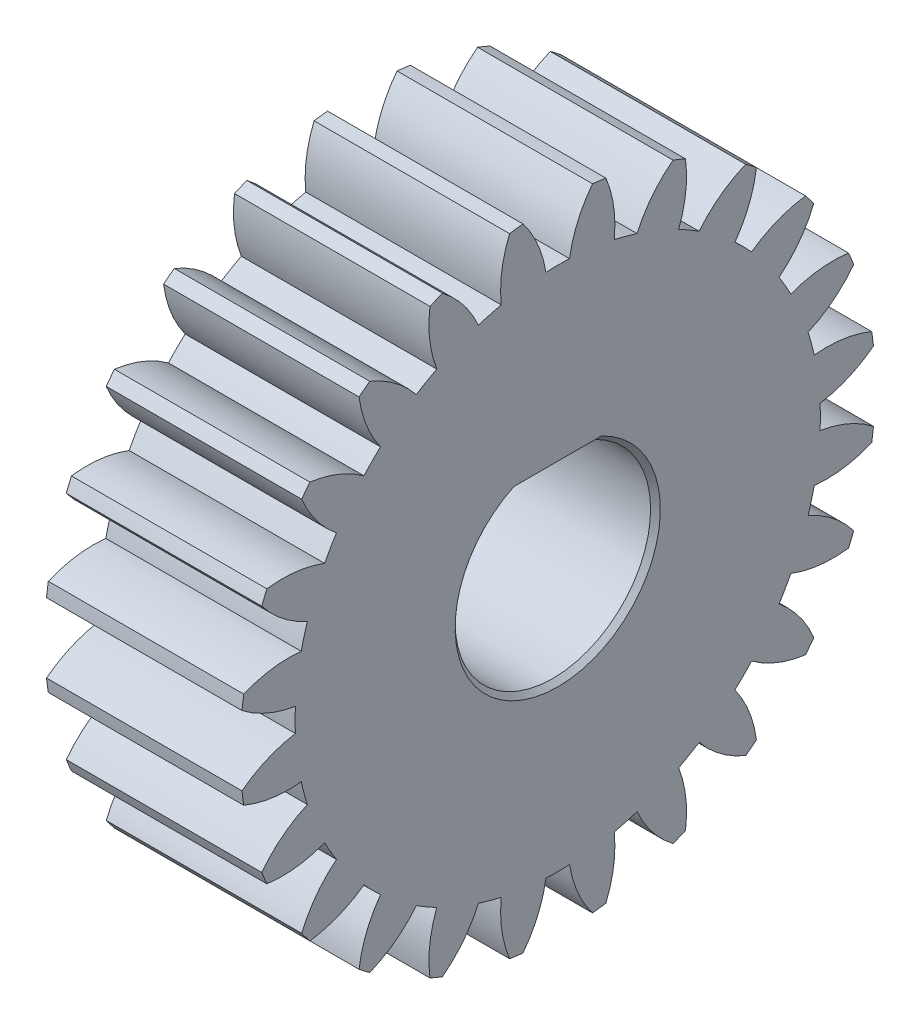
from build123d import *

# Parameters (mm, degrees)
EXTRUDE_1_DEPTH = 4
CHAMFER_1_SIZE  = 0.1


with BuildPart() as part:
    # 草图1 → 凸台-拉伸1 (new body)
    with BuildSketch(Plane(origin=(0, 0, 0), x_dir=(0, -1, 0), z_dir=(-1, 0, 0))):
        with BuildLine():
            ThreePointArc((-0.711337602, 6.460959589), (-0.848420249, 6.444391599), (-0.98512003, 6.424915449))
            ThreePointArc((-0.98512003, 6.424915449), (-1.144628565, 5.84730165), (-1.156074481, 5.248177569))
            ThreePointArc((-1.156074481, 5.248177569), (-1.390893548, 5.19088539), (-1.622898915, 5.123092339))
            ThreePointArc((-1.622898915, 5.123092339), (-1.93237341, 5.636226055), (-2.359318752, 6.056700011))
            ThreePointArc((-2.359318752, 6.056700011), (-2.48744231, 6.005216961), (-2.614443361, 5.951023938))
            ThreePointArc((-2.614443361, 5.951023938), (-2.619019322, 5.351808006), (-2.475010506, 4.770136161))
            ThreePointArc((-2.475010506, 4.770136161), (-2.687, 4.65402052), (-2.893553842, 4.528490053))
            ThreePointArc((-2.893553842, 4.528490053), (-3.325292028, 4.944041268), (-3.846516229, 5.239686336))
            ThreePointArc((-3.846516229, 5.239686336), (-3.956949289, 5.156796712), (-4.065596697, 5.071579981))
            ThreePointArc((-4.065596697, 5.071579981), (-3.91492824, 4.49159749), (-3.625278654, 3.967017857))
            ThreePointArc((-3.625278654, 3.967017857), (-3.799991842, 3.799991842), (-3.967017857, 3.625278654))
            ThreePointArc((-3.967017857, 3.625278654), (-4.49159749, 3.91492824), (-5.071579981, 4.065596697))
            ThreePointArc((-5.071579981, 4.065596697), (-5.156796712, 3.956949289), (-5.239686336, 3.846516229))
            ThreePointArc((-5.239686336, 3.846516229), (-4.944041268, 3.325292028), (-4.528490053, 2.893553842))
            ThreePointArc((-4.528490053, 2.893553842), (-4.65402052, 2.687), (-4.770136161, 2.475010506))
            ThreePointArc((-4.770136161, 2.475010506), (-5.351808006, 2.619019322), (-5.951023938, 2.614443361))
            ThreePointArc((-5.951023938, 2.614443361), (-6.005216961, 2.48744231), (-6.056700011, 2.359318752))
            ThreePointArc((-6.056700011, 2.359318752), (-5.636226055, 1.93237341), (-5.123092339, 1.622898915))
            ThreePointArc((-5.123092339, 1.622898915), (-5.19088539, 1.390893548), (-5.248177569, 1.156074481))
            ThreePointArc((-5.248177569, 1.156074481), (-5.84730165, 1.144628565), (-6.424915449, 0.98512003))
            ThreePointArc((-6.424915449, 0.98512003), (-6.444391599, 0.848420249), (-6.460959589, 0.711337602))
            ThreePointArc((-6.460959589, 0.711337602), (-5.94431135, 0.407766737), (-5.368564348, 0.241646108))
            ThreePointArc((-5.368564348, 0.241646108), (-5.374, 0), (-5.368564348, -0.241646108))
            ThreePointArc((-5.368564348, -0.241646108), (-5.94431135, -0.407766737), (-6.460959589, -0.711337602))
            ThreePointArc((-6.460959589, -0.711337602), (-6.444391599, -0.848420249), (-6.424915449, -0.98512003))
            ThreePointArc((-6.424915449, -0.98512003), (-5.84730165, -1.144628565), (-5.248177569, -1.156074481))
            ThreePointArc((-5.248177569, -1.156074481), (-5.19088539, -1.390893548), (-5.123092339, -1.622898915))
            ThreePointArc((-5.123092339, -1.622898915), (-5.636226055, -1.93237341), (-6.056700011, -2.359318752))
            ThreePointArc((-6.056700011, -2.359318752), (-6.005216961, -2.48744231), (-5.951023938, -2.614443361))
            ThreePointArc((-5.951023938, -2.614443361), (-5.351808006, -2.619019322), (-4.770136161, -2.475010506))
            ThreePointArc((-4.770136161, -2.475010506), (-4.65402052, -2.687), (-4.528490053, -2.893553842))
            ThreePointArc((-4.528490053, -2.893553842), (-4.944041268, -3.325292028), (-5.239686336, -3.846516229))
            ThreePointArc((-5.239686336, -3.846516229), (-5.156796712, -3.956949289), (-5.071579981, -4.065596697))
            ThreePointArc((-5.071579981, -4.065596697), (-4.49159749, -3.91492824), (-3.967017857, -3.625278654))
            ThreePointArc((-3.967017857, -3.625278654), (-3.799991842, -3.799991842), (-3.625278654, -3.967017857))
            ThreePointArc((-3.625278654, -3.967017857), (-3.91492824, -4.49159749), (-4.065596697, -5.071579981))
            ThreePointArc((-4.065596697, -5.071579981), (-3.956949289, -5.156796712), (-3.846516229, -5.239686336))
            ThreePointArc((-3.846516229, -5.239686336), (-3.325292028, -4.944041268), (-2.893553842, -4.528490053))
            ThreePointArc((-2.893553842, -4.528490053), (-2.687, -4.65402052), (-2.475010506, -4.770136161))
            ThreePointArc((-2.475010506, -4.770136161), (-2.619019322, -5.351808006), (-2.614443361, -5.951023938))
            ThreePointArc((-2.614443361, -5.951023938), (-2.48744231, -6.005216961), (-2.359318752, -6.056700011))
            ThreePointArc((-2.359318752, -6.056700011), (-1.93237341, -5.636226055), (-1.622898915, -5.123092339))
            ThreePointArc((-1.622898915, -5.123092339), (-1.390893548, -5.19088539), (-1.156074481, -5.248177569))
            ThreePointArc((-1.156074481, -5.248177569), (-1.144628565, -5.84730165), (-0.98512003, -6.424915449))
            ThreePointArc((-0.98512003, -6.424915449), (-0.848420249, -6.444391599), (-0.711337602, -6.460959589))
            ThreePointArc((-0.711337602, -6.460959589), (-0.407766737, -5.94431135), (-0.241646108, -5.368564348))
            ThreePointArc((-0.241646108, -5.368564348), (0, -5.374), (0.241646108, -5.368564348))
            ThreePointArc((0.241646108, -5.368564348), (0.407766737, -5.94431135), (0.711337602, -6.460959589))
            ThreePointArc((0.711337602, -6.460959589), (0.848420249, -6.444391599), (0.98512003, -6.424915449))
            ThreePointArc((0.98512003, -6.424915449), (1.144628565, -5.84730165), (1.156074481, -5.248177569))
            ThreePointArc((1.156074481, -5.248177569), (1.390893548, -5.19088539), (1.622898915, -5.123092339))
            ThreePointArc((1.622898915, -5.123092339), (1.93237341, -5.636226055), (2.359318752, -6.056700011))
            ThreePointArc((2.359318752, -6.056700011), (2.48744231, -6.005216961), (2.614443361, -5.951023938))
            ThreePointArc((2.614443361, -5.951023938), (2.619019322, -5.351808006), (2.475010506, -4.770136161))
            ThreePointArc((2.475010506, -4.770136161), (2.687, -4.65402052), (2.893553842, -4.528490053))
            ThreePointArc((2.893553842, -4.528490053), (3.325292028, -4.944041268), (3.846516229, -5.239686336))
            ThreePointArc((3.846516229, -5.239686336), (3.956949289, -5.156796712), (4.065596697, -5.071579981))
            ThreePointArc((4.065596697, -5.071579981), (3.91492824, -4.49159749), (3.625278654, -3.967017857))
            ThreePointArc((3.625278654, -3.967017857), (3.799991842, -3.799991842), (3.967017857, -3.625278654))
            ThreePointArc((3.967017857, -3.625278654), (4.49159749, -3.91492824), (5.071579981, -4.065596697))
            ThreePointArc((5.071579981, -4.065596697), (5.156796712, -3.956949289), (5.239686336, -3.846516229))
            ThreePointArc((5.239686336, -3.846516229), (4.944041268, -3.325292028), (4.528490053, -2.893553842))
            ThreePointArc((4.528490053, -2.893553842), (4.65402052, -2.687), (4.770136161, -2.475010506))
            ThreePointArc((4.770136161, -2.475010506), (5.351808006, -2.619019322), (5.951023938, -2.614443361))
            ThreePointArc((5.951023938, -2.614443361), (6.005216961, -2.48744231), (6.056700011, -2.359318752))
            ThreePointArc((6.056700011, -2.359318752), (5.636226055, -1.93237341), (5.123092339, -1.622898915))
            ThreePointArc((5.123092339, -1.622898915), (5.19088539, -1.390893548), (5.248177569, -1.156074481))
            ThreePointArc((5.248177569, -1.156074481), (5.84730165, -1.144628565), (6.424915449, -0.98512003))
            ThreePointArc((6.424915449, -0.98512003), (6.444391599, -0.848420249), (6.460959589, -0.711337602))
            ThreePointArc((6.460959589, -0.711337602), (5.94431135, -0.407766737), (5.368564348, -0.241646108))
            ThreePointArc((5.368564348, -0.241646108), (5.374, 0), (5.368564348, 0.241646108))
            ThreePointArc((5.368564348, 0.241646108), (5.94431135, 0.407766737), (6.460959589, 0.711337602))
            ThreePointArc((6.460959589, 0.711337602), (6.444391599, 0.848420249), (6.424915449, 0.98512003))
            ThreePointArc((6.424915449, 0.98512003), (5.84730165, 1.144628565), (5.248177569, 1.156074481))
            ThreePointArc((5.248177569, 1.156074481), (5.19088539, 1.390893548), (5.123092339, 1.622898915))
            ThreePointArc((5.123092339, 1.622898915), (5.636226055, 1.93237341), (6.056700011, 2.359318752))
            ThreePointArc((6.056700011, 2.359318752), (6.005216961, 2.48744231), (5.951023938, 2.614443361))
            ThreePointArc((5.951023938, 2.614443361), (5.351808006, 2.619019322), (4.770136161, 2.475010506))
            ThreePointArc((4.770136161, 2.475010506), (4.65402052, 2.687), (4.528490053, 2.893553842))
            ThreePointArc((4.528490053, 2.893553842), (4.944041268, 3.325292028), (5.239686336, 3.846516229))
            ThreePointArc((5.239686336, 3.846516229), (5.156796712, 3.956949289), (5.071579981, 4.065596697))
            ThreePointArc((5.071579981, 4.065596697), (4.49159749, 3.91492824), (3.967017857, 3.625278654))
            ThreePointArc((3.967017857, 3.625278654), (3.799991842, 3.799991842), (3.625278654, 3.967017857))
            ThreePointArc((3.625278654, 3.967017857), (3.91492824, 4.49159749), (4.065596697, 5.071579981))
            ThreePointArc((4.065596697, 5.071579981), (3.956949289, 5.156796712), (3.846516229, 5.239686336))
            ThreePointArc((3.846516229, 5.239686336), (3.325292028, 4.944041268), (2.893553842, 4.528490053))
            ThreePointArc((2.893553842, 4.528490053), (2.687, 4.65402052), (2.475010506, 4.770136161))
            ThreePointArc((2.475010506, 4.770136161), (2.619019322, 5.351808006), (2.614443361, 5.951023938))
            ThreePointArc((2.614443361, 5.951023938), (2.48744231, 6.005216961), (2.359318752, 6.056700011))
            ThreePointArc((2.359318752, 6.056700011), (1.93237341, 5.636226055), (1.622898915, 5.123092339))
            ThreePointArc((1.622898915, 5.123092339), (1.390893548, 5.19088539), (1.156074481, 5.248177569))
            ThreePointArc((1.156074481, 5.248177569), (1.144628565, 5.84730165), (0.98512003, 6.424915449))
            ThreePointArc((0.98512003, 6.424915449), (0.848420249, 6.444391599), (0.711337602, 6.460959589))
            ThreePointArc((0.711337602, 6.460959589), (0.407766737, 5.94431135), (0.241646108, 5.368564348))
            ThreePointArc((0.241646108, 5.368564348), (0, 5.374), (-0.241646108, 5.368564348))
            ThreePointArc((-0.241646108, 5.368564348), (-0.407766737, 5.94431135), (-0.711337602, 6.460959589))
        make_face()
        with BuildLine():
            Line((-1.8, -0.871779789), (-1.8, 0.871779789))
            ThreePointArc((-1.8, 0.871779789), (2, 0), (-1.8, -0.871779789))
        make_face(mode=Mode.SUBTRACT)
    extrude(amount=-EXTRUDE_1_DEPTH)

    # 倒角1
    chamfer_1_edges = [part.edges().sort_by_distance(p)[0] for p in [
        (4, -2, 0),
        (4, 1.8, 0),
        (0, -2, 0),
        (0, 1.8, 0),
    ]]
    chamfer(chamfer_1_edges, length=CHAMFER_1_SIZE)


solid = part.part
